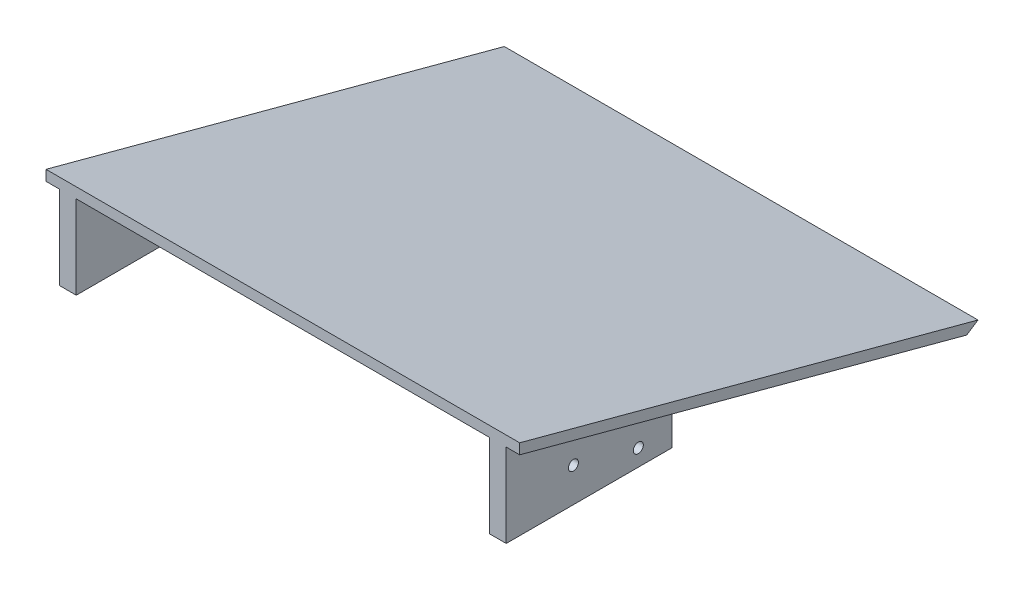
from build123d import *

# Parameters (mm, degrees)
BOSS_EXTRUDE1_DEPTH = 70.5
SKETCH2_R           = 1.5
BOSS_EXTRUDE2_DEPTH = 5


with BuildPart() as part:
    # Sketch1 → Boss-Extrude1 (new, symmetric)
    with BuildSketch(Plane(origin=(0, 0, 0), x_dir=(0, 0, -1), z_dir=(1, 0, 0))):
        Polygon((0, 0), (133.046623313, -35.649735272), (136.43225101, -33.451082938), (0, 3.105828541), align=None)
    extrude(amount=BOSS_EXTRUDE1_DEPTH, both=True)

    # Sketch2 → Boss-Extrude2 (add)
    with BuildSketch(Plane.ZY.offset(66.5)):
        Polygon((0, 0), (0, -24.852850374), (-49.318516526, -24.852850374), (-49.318516526, -13.214856675), align=None)
        with Locations((-20, -14.676469472)):
            Circle(SKETCH2_R, mode=Mode.SUBTRACT)
        with Locations((-39.318516526, -19.852850374)):
            Circle(SKETCH2_R, mode=Mode.SUBTRACT)
    boss_extrude2 = extrude(amount=-BOSS_EXTRUDE2_DEPTH)

    # Mirror1: Boss-Extrude2 across plane
    add(boss_extrude2.mirror(Plane(origin=(0, 0, 0), x_dir=(0, 0, 1), z_dir=(1, 0, 0))))


solid = part.part
